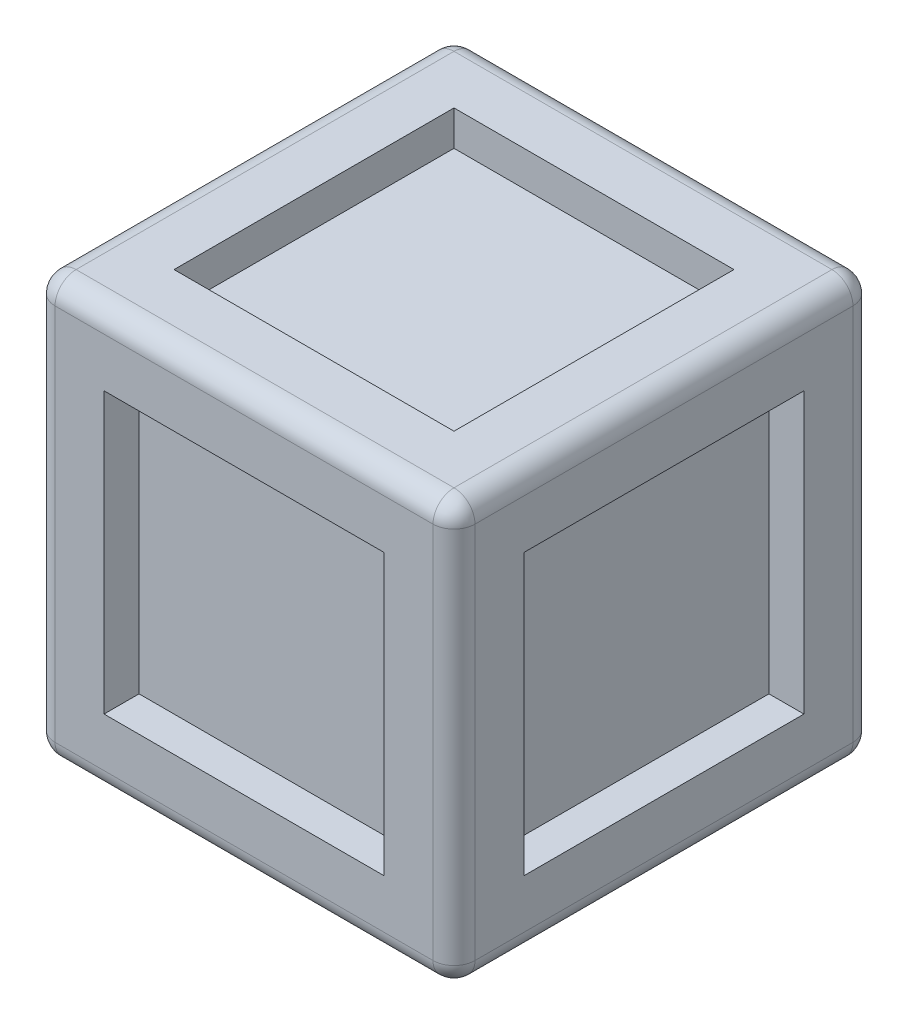
from build123d import *

# Parameters (mm, degrees)
DODANIE_WYCI_GNI_CIE1_DEPTH      = 30
DODANIE_WYCI_GNI_CIE1_DEPTH_BACK = 30
SZKIC1_W                         = 60
SZKIC1_H                         = 60
ZAOKR_GLENIE1_R                  = 3
SZKIC2_W                         = 40
SZKIC2_H                         = 40
WYTNIJ_WYCI_GNI_CIE1_DEPTH       = 5
SZYK_KO_OWY1_COUNT               = 4
SZYK_KO_OWY2_COPY_1_SKETCH_W     = 40
SZYK_KO_OWY2_COPY_1_SKETCH_H     = 40
SZYK_KO_OWY2_COPY_1_DEPTH        = 5
SZYK_KO_OWY2_COPY_2_SKETCH_W     = 40
SZYK_KO_OWY2_COPY_2_SKETCH_H     = 40
SZYK_KO_OWY2_COPY_2_DEPTH        = 5
SZYK_KO_OWY2_COPY_3_SKETCH_W     = 40
SZYK_KO_OWY2_COPY_3_SKETCH_H     = 40
SZYK_KO_OWY2_COPY_3_DEPTH        = 5
SZYK_KO_OWY2_COPY_4_SKETCH_W     = 40
SZYK_KO_OWY2_COPY_4_SKETCH_H     = 40
SZYK_KO_OWY2_COPY_4_DEPTH        = 5
SZYK_KO_OWY2_COPY_5_SKETCH_W     = 40
SZYK_KO_OWY2_COPY_5_SKETCH_H     = 40
SZYK_KO_OWY2_COPY_5_DEPTH        = 5
SZYK_KO_OWY2_COPY_6_SKETCH_W     = 40
SZYK_KO_OWY2_COPY_6_SKETCH_H     = 40
SZYK_KO_OWY2_COPY_6_DEPTH        = 5
SZYK_KO_OWY2_COPY_7_SKETCH_W     = 40
SZYK_KO_OWY2_COPY_7_SKETCH_H     = 40
SZYK_KO_OWY2_COPY_7_DEPTH        = 5
SZYK_KO_OWY2_COPY_8_SKETCH_W     = 40
SZYK_KO_OWY2_COPY_8_SKETCH_H     = 40
SZYK_KO_OWY2_COPY_8_DEPTH        = 5
SZYK_KO_OWY2_COPY_9_SKETCH_W     = 40
SZYK_KO_OWY2_COPY_9_SKETCH_H     = 40
SZYK_KO_OWY2_COPY_9_DEPTH        = 5
SZYK_KO_OWY2_COPY_10_SKETCH_W    = 40
SZYK_KO_OWY2_COPY_10_SKETCH_H    = 40
SZYK_KO_OWY2_COPY_10_DEPTH       = 5
SZYK_KO_OWY2_COPY_11_SKETCH_W    = 40
SZYK_KO_OWY2_COPY_11_SKETCH_H    = 40
SZYK_KO_OWY2_COPY_11_DEPTH       = 5
SZYK_KO_OWY2_COPY_12_SKETCH_W    = 40
SZYK_KO_OWY2_COPY_12_SKETCH_H    = 40
SZYK_KO_OWY2_COPY_12_DEPTH       = 5


with BuildPart() as part:
    # Szkic1 → Dodanie-wyciągnięcie1 (new, two sides: drawn at the far end of the back side and taken through both)
    with BuildSketch(Plane.XY.offset(-DODANIE_WYCI_GNI_CIE1_DEPTH_BACK)):
        Rectangle(SZKIC1_W, SZKIC1_H)
    extrude(amount=DODANIE_WYCI_GNI_CIE1_DEPTH + DODANIE_WYCI_GNI_CIE1_DEPTH_BACK)

    # Zaokrąglenie1
    zaokr_glenie1_edges = [part.edges().sort_by_distance(p)[0] for p in [
        (-30, -30, 0),
        (0, -30, -30),
        (-30, 0, -30),
        (30, 0, -30),
        (30, -30, 0),
        (0, 30, -30),
        (30, 30, 0),
        (-30, 30, 0),
        (0, 30, 30),
        (30, 0, 30),
        (0, -30, 30),
        (-30, 0, 30),
    ]]
    fillet(zaokr_glenie1_edges, radius=ZAOKR_GLENIE1_R)

    # Szkic2 → Wytnij-wyciągnięcie1 (cut)
    with BuildSketch(Plane.XY.offset(30)):
        Rectangle(SZKIC2_W, SZKIC2_H)
    wytnij_wyci_gni_cie1 = extrude(amount=-WYTNIJ_WYCI_GNI_CIE1_DEPTH, mode=Mode.SUBTRACT)

    # Szyk kołowy1: Wytnij-wyciągnięcie1 ×4 about axis
    szyk_ko_owy1_axis = Axis((-33, 0, 0), (1, 0, 0))
    for i in range(1, SZYK_KO_OWY1_COUNT):
        add(wytnij_wyci_gni_cie1.rotate(szyk_ko_owy1_axis, i * 360 / SZYK_KO_OWY1_COUNT), mode=Mode.SUBTRACT)

    # Szyk kołowy2 copy 1 sketch → Szyk kołowy2 copy 1 (cut)
    with BuildSketch(Plane.YZ.offset(30)):
        Rectangle(SZYK_KO_OWY2_COPY_1_SKETCH_W, SZYK_KO_OWY2_COPY_1_SKETCH_H)
    extrude(amount=-SZYK_KO_OWY2_COPY_1_DEPTH, mode=Mode.SUBTRACT)

    # Szyk kołowy2 copy 2 sketch → Szyk kołowy2 copy 2 (cut)
    with BuildSketch(Plane(origin=(0, 30, 0), x_dir=(-1, 0, 0), z_dir=(0, 1, 0))):
        Rectangle(SZYK_KO_OWY2_COPY_2_SKETCH_W, SZYK_KO_OWY2_COPY_2_SKETCH_H)
    extrude(amount=-SZYK_KO_OWY2_COPY_2_DEPTH, mode=Mode.SUBTRACT)

    # Szyk kołowy2 copy 3 sketch → Szyk kołowy2 copy 3 (cut)
    with BuildSketch(Plane(origin=(-30, 0, 0), x_dir=(0, -1, 0), z_dir=(-1, 0, 0))):
        Rectangle(SZYK_KO_OWY2_COPY_3_SKETCH_W, SZYK_KO_OWY2_COPY_3_SKETCH_H)
    extrude(amount=-SZYK_KO_OWY2_COPY_3_DEPTH, mode=Mode.SUBTRACT)

    # Szyk kołowy2 copy 4 sketch → Szyk kołowy2 copy 4 (cut)
    with BuildSketch(Plane.YX.offset(30)):
        Rectangle(SZYK_KO_OWY2_COPY_4_SKETCH_W, SZYK_KO_OWY2_COPY_4_SKETCH_H)
    extrude(amount=-SZYK_KO_OWY2_COPY_4_DEPTH, mode=Mode.SUBTRACT)

    # Szyk kołowy2 copy 5 sketch → Szyk kołowy2 copy 5 (cut)
    with BuildSketch(Plane(origin=(0, 0, -30), x_dir=(-1, 0, 0), z_dir=(0, 0, -1))):
        Rectangle(SZYK_KO_OWY2_COPY_5_SKETCH_W, SZYK_KO_OWY2_COPY_5_SKETCH_H)
    extrude(amount=-SZYK_KO_OWY2_COPY_5_DEPTH, mode=Mode.SUBTRACT)

    # Szyk kołowy2 copy 6 sketch → Szyk kołowy2 copy 6 (cut)
    with BuildSketch(Plane(origin=(0, 0, -30), x_dir=(0, -1, 0), z_dir=(0, 0, -1))):
        Rectangle(SZYK_KO_OWY2_COPY_6_SKETCH_W, SZYK_KO_OWY2_COPY_6_SKETCH_H)
    extrude(amount=-SZYK_KO_OWY2_COPY_6_DEPTH, mode=Mode.SUBTRACT)

    # Szyk kołowy2 copy 7 sketch → Szyk kołowy2 copy 7 (cut)
    with BuildSketch(Plane(origin=(-30, 0, 0), x_dir=(0, 1, 0), z_dir=(-1, 0, 0))):
        Rectangle(SZYK_KO_OWY2_COPY_7_SKETCH_W, SZYK_KO_OWY2_COPY_7_SKETCH_H)
    extrude(amount=-SZYK_KO_OWY2_COPY_7_DEPTH, mode=Mode.SUBTRACT)

    # Szyk kołowy2 copy 8 sketch → Szyk kołowy2 copy 8 (cut)
    with BuildSketch(Plane(origin=(0, -30, 0), x_dir=(-1, 0, 0), z_dir=(0, -1, 0))):
        Rectangle(SZYK_KO_OWY2_COPY_8_SKETCH_W, SZYK_KO_OWY2_COPY_8_SKETCH_H)
    extrude(amount=-SZYK_KO_OWY2_COPY_8_DEPTH, mode=Mode.SUBTRACT)

    # Szyk kołowy2 copy 9 sketch → Szyk kołowy2 copy 9 (cut)
    with BuildSketch(Plane(origin=(30, 0, 0), x_dir=(0, -1, 0), z_dir=(1, 0, 0))):
        Rectangle(SZYK_KO_OWY2_COPY_9_SKETCH_W, SZYK_KO_OWY2_COPY_9_SKETCH_H)
    extrude(amount=-SZYK_KO_OWY2_COPY_9_DEPTH, mode=Mode.SUBTRACT)

    # Szyk kołowy2 copy 10 sketch → Szyk kołowy2 copy 10 (cut)
    with BuildSketch(Plane(origin=(0, 0, 30), x_dir=(0, 1, 0), z_dir=(0, 0, 1))):
        Rectangle(SZYK_KO_OWY2_COPY_10_SKETCH_W, SZYK_KO_OWY2_COPY_10_SKETCH_H)
    extrude(amount=-SZYK_KO_OWY2_COPY_10_DEPTH, mode=Mode.SUBTRACT)

    # Szyk kołowy2 copy 11 sketch → Szyk kołowy2 copy 11 (cut)
    with BuildSketch(Plane(origin=(0, 0, 30), x_dir=(-1, 0, 0), z_dir=(0, 0, 1))):
        Rectangle(SZYK_KO_OWY2_COPY_11_SKETCH_W, SZYK_KO_OWY2_COPY_11_SKETCH_H)
    extrude(amount=-SZYK_KO_OWY2_COPY_11_DEPTH, mode=Mode.SUBTRACT)

    # Szyk kołowy2 copy 12 sketch → Szyk kołowy2 copy 12 (cut)
    with BuildSketch(Plane(origin=(0, 0, 30), x_dir=(0, -1, 0), z_dir=(0, 0, 1))):
        Rectangle(SZYK_KO_OWY2_COPY_12_SKETCH_W, SZYK_KO_OWY2_COPY_12_SKETCH_H)
    extrude(amount=-SZYK_KO_OWY2_COPY_12_DEPTH, mode=Mode.SUBTRACT)


solid = part.part
